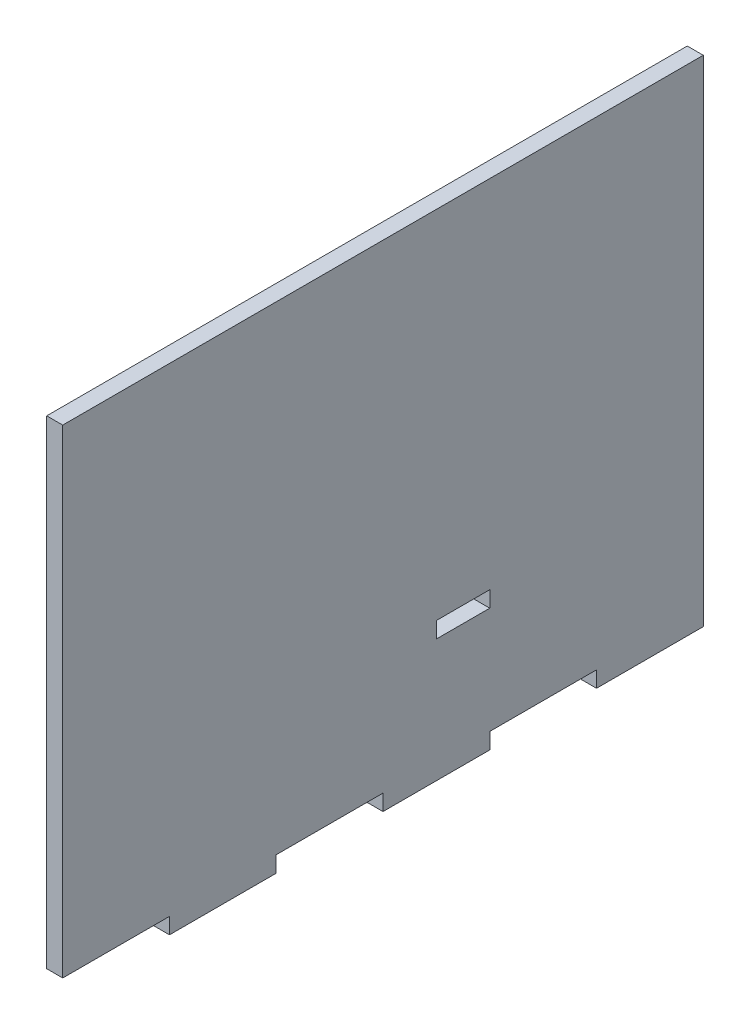
from build123d import *

# Parameters (mm, degrees)
CROQUIS1_W              = 10
CROQUIS1_H              = 3
SALIENTE_EXTRUIR1_DEPTH = 3


with BuildPart() as part:
    # Croquis1 → Saliente-Extruir1 (new body)
    with BuildSketch(Plane(origin=(0, 0, 0), x_dir=(0, 0, -1), z_dir=(1, 0, 0))):
        Polygon((-60.530143817, -78.620199336), (-40.530143817, -78.620199336), (-40.530143817, -81.620199336), (-20.530143817, -81.620199336), (-20.530143817, -78.620199336), (-0.530143817, -78.620199336), (-0.530143817, -81.620199336), (19.469856183, -81.620199336), (19.469856183, -78.620199336), (39.469856183, -78.620199336), (39.469856183, -81.620199336), (59.469856183, -81.620199336), (59.469856183, 11.086867688), (-60.530143817, 11.086867688), align=None)
        with Locations((14.469856183, -57.120199336)):
            Rectangle(CROQUIS1_W, CROQUIS1_H, mode=Mode.SUBTRACT)
    extrude(amount=SALIENTE_EXTRUIR1_DEPTH)


solid = part.part
